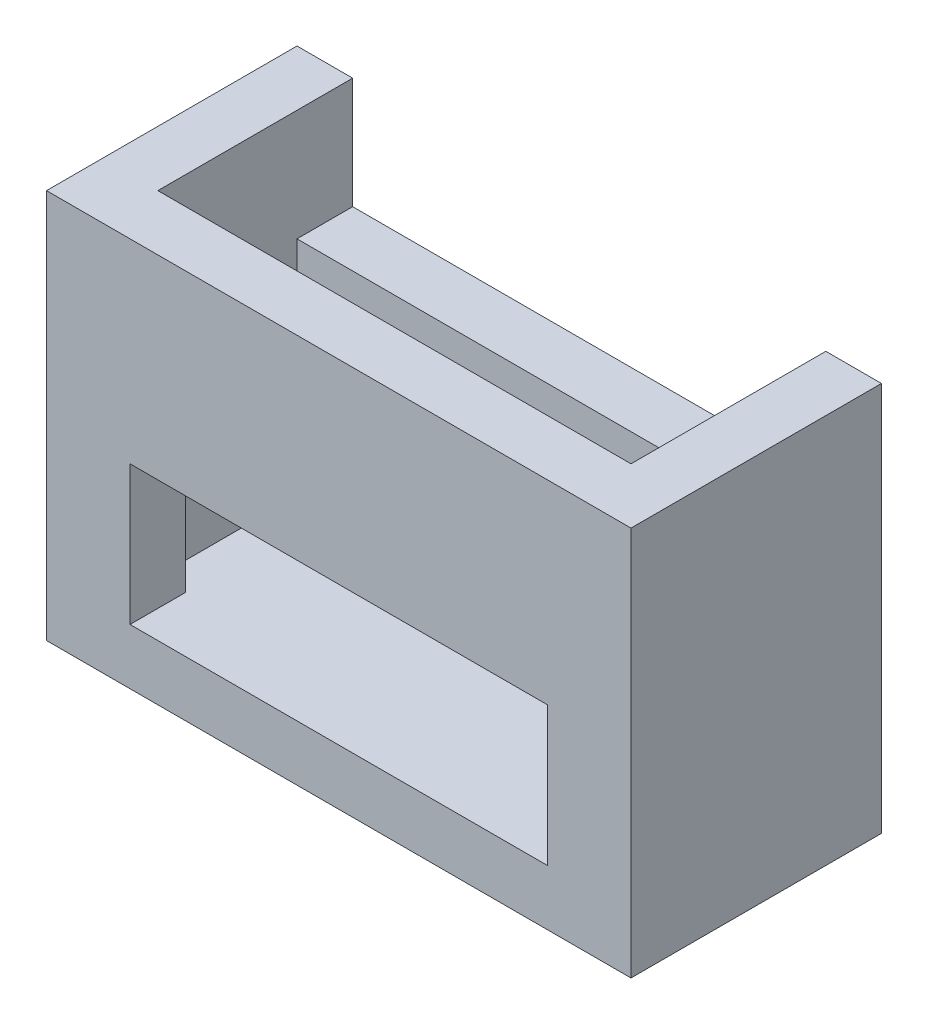
from build123d import *

# Parameters (mm, degrees)
SKETCH2_W           = 21
SKETCH2_H           = 14
BOSS_EXTRUDE1_DEPTH = 9
SKETCH3_W           = 15
SKETCH3_H           = 5
CUT_EXTRUDE1_DEPTH  = 5
SKETCH6_W           = 17
SKETCH6_H           = 7
CUT_EXTRUDE3_DEPTH  = 4
SKETCH7_W           = 17
SKETCH7_H           = 5
CUT_EXTRUDE4_DEPTH  = 4
SKETCH8_W           = 1
SKETCH8_H           = 3
CUT_EXTRUDE6_DEPTH  = 4


with BuildPart() as part:
    # Sketch2 → Boss-Extrude1 (new body)
    with BuildSketch(Plane.XY):
        Rectangle(SKETCH2_W, SKETCH2_H)
    extrude(amount=BOSS_EXTRUDE1_DEPTH)

    # Sketch3 → Cut-Extrude1 (cut)
    with BuildSketch(Plane.XY.offset(9)):
        with Locations((0, -2.5)):
            Rectangle(SKETCH3_W, SKETCH3_H)
    extrude(amount=-CUT_EXTRUDE1_DEPTH, mode=Mode.SUBTRACT)

    # Sketch6 → Cut-Extrude3 (cut)
    with BuildSketch(Plane(origin=(0, 7, 0), x_dir=(1, 0, 0), z_dir=(0, 1, 0))):
        with Locations((0, -3.5)):
            Rectangle(SKETCH6_W, SKETCH6_H)
    extrude(amount=-CUT_EXTRUDE3_DEPTH, mode=Mode.SUBTRACT)

    # Sketch7 → Cut-Extrude4 (cut)
    with BuildSketch(Plane(origin=(0, 3, 0), x_dir=(1, 0, 0), z_dir=(0, 1, 0))):
        with Locations((0, -4.5)):
            Rectangle(SKETCH7_W, SKETCH7_H)
    extrude(amount=-CUT_EXTRUDE4_DEPTH, mode=Mode.SUBTRACT)

    # Sketch8 → Cut-Extrude6 (cut)
    with BuildSketch(Plane(origin=(0, -1, 0), x_dir=(1, 0, 0), z_dir=(0, 1, 0))):
        with Locations((-8, -5.5)):
            Rectangle(SKETCH8_W, SKETCH8_H)
        with Locations((8, -5.5)):
            Rectangle(SKETCH8_W, SKETCH8_H)
    extrude(amount=-CUT_EXTRUDE6_DEPTH, mode=Mode.SUBTRACT)


solid = part.part
